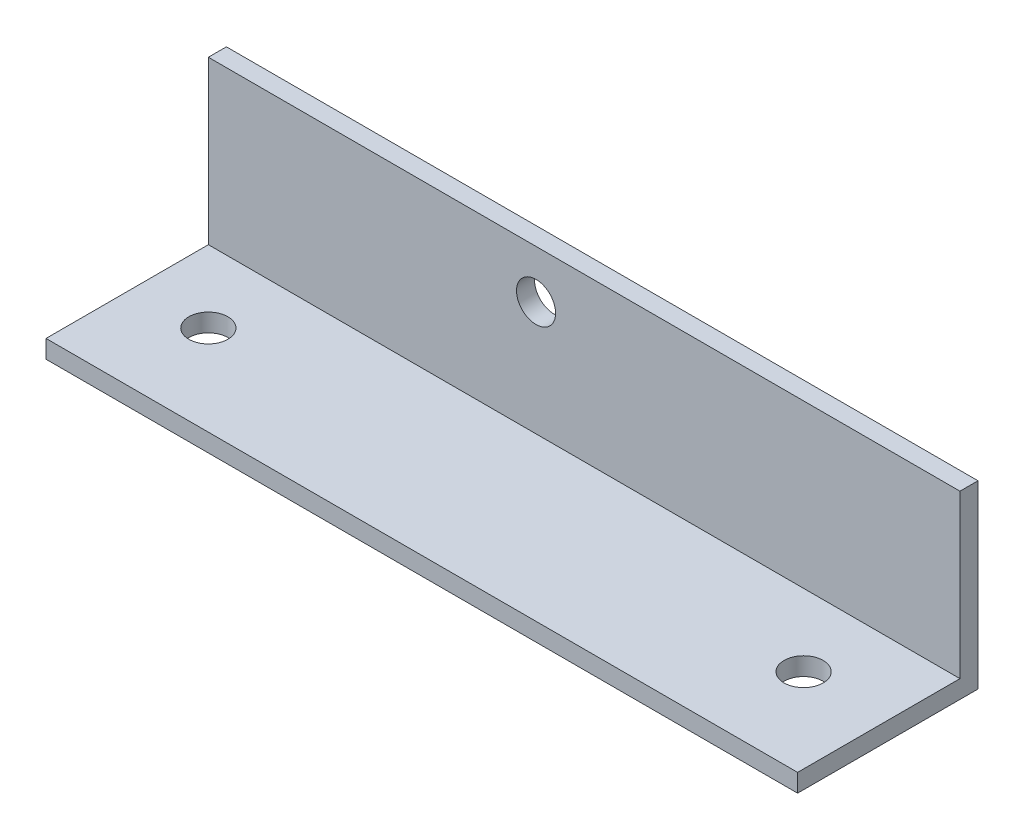
from build123d import *

# Parameters (mm, degrees)
SKETCH1_W                      = 125
SKETCH1_H                      = 30
BOSS_EXTRUDE1_DEPTH            = 3
SKETCH2_W                      = 125
SKETCH2_H                      = 3
BOSS_EXTRUDE2_DEPTH            = 27
F_6_5_6_5_DIAMETER_HOLE1_D     = 6.5
F_6_5_6_5_DIAMETER_HOLE1_DEPTH = 10
F_6_5_6_5_DIAMETER_HOLE1_TIP   = 1.952797012
F_6_5_6_5_DIAMETER_HOLE2_D     = 6.5
F_6_5_6_5_DIAMETER_HOLE2_DEPTH = 32
F_6_5_6_5_DIAMETER_HOLE2_TIP   = 1.952797012


with BuildPart() as part:
    # Sketch1 → Boss-Extrude1 (new body)
    with BuildSketch(Plane.XY):
        Rectangle(SKETCH1_W, SKETCH1_H)
    extrude(amount=BOSS_EXTRUDE1_DEPTH)

    # Sketch2 → Boss-Extrude2 (add)
    with BuildSketch(Plane.XY.offset(3)):
        with Locations((0, -13.5)):
            Rectangle(SKETCH2_W, SKETCH2_H)
    extrude(amount=BOSS_EXTRUDE2_DEPTH)

    # Ø6.5 (6.5) Diameter Hole1
    with Locations(Plane(origin=(0, -12, 0), x_dir=(1, 0, 0), z_dir=(0, 1, 0))):
        with Locations((48.5, -15), (-50.5, -15)):
            Hole(F_6_5_6_5_DIAMETER_HOLE1_D / 2, depth=F_6_5_6_5_DIAMETER_HOLE1_DEPTH)
            with Locations((0, 0, -(F_6_5_6_5_DIAMETER_HOLE1_DEPTH + F_6_5_6_5_DIAMETER_HOLE1_TIP / 2))):  # 118° drill point
                Cone(0, F_6_5_6_5_DIAMETER_HOLE1_D / 2, F_6_5_6_5_DIAMETER_HOLE1_TIP, mode=Mode.SUBTRACT)

    # Ø6.5 (6.5) Diameter Hole2
    with Locations(Plane(origin=(0, 0, 0), x_dir=(-1, 0, 0), z_dir=(0, 0, -1))):
        with Locations((8.000002921, 7)):
            Hole(F_6_5_6_5_DIAMETER_HOLE2_D / 2, depth=F_6_5_6_5_DIAMETER_HOLE2_DEPTH)
            with Locations((0, 0, -(F_6_5_6_5_DIAMETER_HOLE2_DEPTH + F_6_5_6_5_DIAMETER_HOLE2_TIP / 2))):  # 118° drill point
                Cone(0, F_6_5_6_5_DIAMETER_HOLE2_D / 2, F_6_5_6_5_DIAMETER_HOLE2_TIP, mode=Mode.SUBTRACT)


solid = part.part
